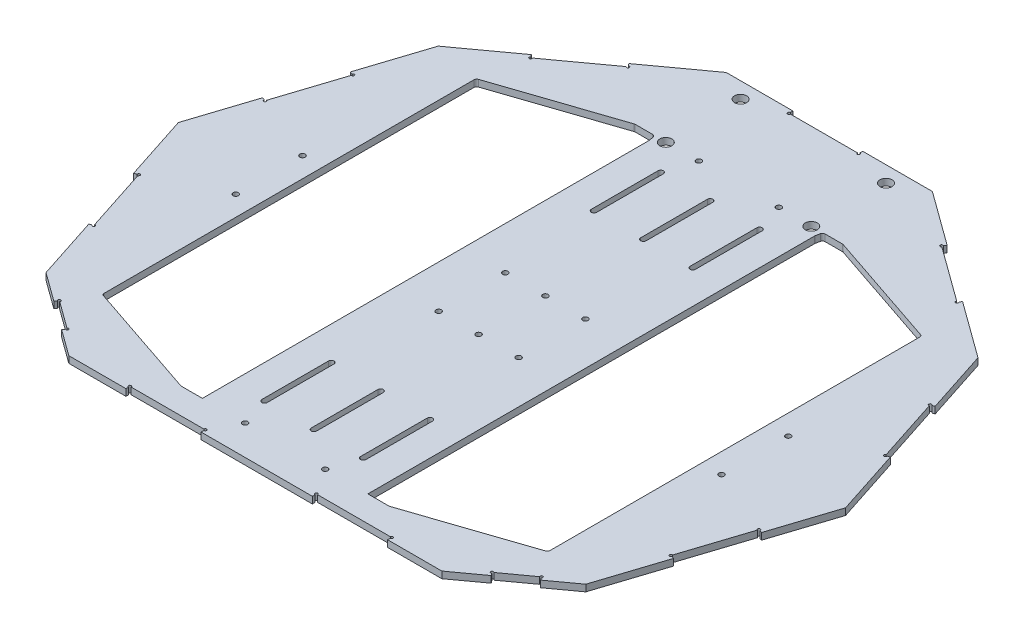
from build123d import *

# Parameters (mm, degrees)
SKETCH1_R           = 250
BOSS_EXTRUDE1_DEPTH = 5
SKETCH2_W           = 94
SKETCH2_H           = 280
CUT_EXTRUDE1_DEPTH  = 354.588744165
SKETCH3_R           = 2
CUT_EXTRUDE2_DEPTH  = 354.588744165
SKETCH4_W           = 10
SKETCH4_H           = 135
SKETCH4_H_2         = 40
SKETCH4_H_3         = 32.5
SKETCH4_H_4         = 72.5
CUT_EXTRUDE3_DEPTH  = 354.588744165
SKETCH5_OUTSIDE_W   = 643.424
SKETCH5_OUTSIDE_H   = 643.424
CUT_EXTRUDE4_DEPTH  = 6
CUT_EXTRUDE5_DEPTH  = 346.046056454
SKETCH7_W           = 52.3
SKETCH7_H           = 3
SKETCH7_W_2         = 56.4
CUT_EXTRUDE6_DEPTH  = 346.046056454
SKETCH8_R           = 1
CUT_EXTRUDE7_DEPTH  = 346.046056454
SKETCH9_W           = 15
SKETCH9_H           = 30
CUT_EXTRUDE8_DEPTH  = 346.046056454
SKETCH12_W          = 10
SKETCH12_H          = 20
CUT_EXTRUDE9_DEPTH  = 346.046056454
SKETCH14_R          = 2
CUT_EXTRUDE11_DEPTH = 346.046056454
CUT_EXTRUDE13_DEPTH = 346.046056454
FILLET1_R           = 2
SKETCH17_R          = 4.5
CUT_EXTRUDE14_DEPTH = 346.046056454
CUT_EXTRUDE15_DEPTH = 346.046056454
FILLET2_R           = 2


with BuildPart() as part:
    # Sketch1 → Boss-Extrude1 (new body)
    with BuildSketch(Plane(origin=(0, 0, 0), x_dir=(1, 0, 0), z_dir=(0, 1, 0))):
        with Locations(Location((0, 0, 0), (0, 0, 270))):
            Circle(SKETCH1_R)
    extrude(amount=BOSS_EXTRUDE1_DEPTH)

    # Sketch2 → Cut-Extrude1 (cut, through all)
    with BuildSketch(Plane(origin=(0, 5, 0), x_dir=(1, 0, 0), z_dir=(0, 1, 0))):
        with Locations((120, 0)):
            Rectangle(SKETCH2_W, SKETCH2_H)
        with Locations((-120, 0)):
            Rectangle(SKETCH2_W, SKETCH2_H)
    extrude(amount=-CUT_EXTRUDE1_DEPTH, mode=Mode.SUBTRACT)

    # Sketch3 → Cut-Extrude2 (cut, through all)
    with BuildSketch(Plane(origin=(0, 5, 0), x_dir=(1, 0, 0), z_dir=(0, 1, 0))):
        with Locations(Location((0, 25, 0), (0, 0, 270))):
            Circle(SKETCH3_R)
        with Locations(Location((0, -25, 0), (0, 0, 270))):
            Circle(SKETCH3_R)
        with Locations(Location((-182, -25, 0), (0, 0, 270))):
            Circle(SKETCH3_R)
        with Locations(Location((-182, 25, 0), (0, 0, 270))):
            Circle(SKETCH3_R)
        with Locations(Location((182, -25, 0), (0, 0, 270))):
            Circle(SKETCH3_R)
        with Locations(Location((182, 25, 0), (0, 0, 270))):
            Circle(SKETCH3_R)
    extrude(amount=-CUT_EXTRUDE2_DEPTH, mode=Mode.SUBTRACT)

    # Sketch4 → Cut-Extrude3 (cut, through all)
    with BuildSketch(Plane(origin=(0, 5, 0), x_dir=(1, 0, 0), z_dir=(0, 1, 0))):
        with Locations((68, 0)):
            Rectangle(SKETCH4_W, SKETCH4_H)
        with Locations((-68, 0)):
            Rectangle(SKETCH4_W, SKETCH4_H)
        with Locations((-68, 87.5)):
            Rectangle(SKETCH4_W, SKETCH4_H_2)
        with Locations((68, -87.5)):
            Rectangle(SKETCH4_W, SKETCH4_H_2)
        with Locations((-68, 123.75)):
            Rectangle(SKETCH4_W, SKETCH4_H_3)
        with Locations((68, -123.75)):
            Rectangle(SKETCH4_W, SKETCH4_H_3)
        with Locations((-68, -103.75)):
            Rectangle(SKETCH4_W, SKETCH4_H_4)
        with Locations((68, 103.75)):
            Rectangle(SKETCH4_W, SKETCH4_H_4)
    extrude(amount=-CUT_EXTRUDE3_DEPTH, mode=Mode.SUBTRACT)

    # Sketch5 outside → Cut-Extrude4 (cut)
    with BuildSketch(Plane(origin=(0, 5, 0), x_dir=(1, 0, 0), z_dir=(0, 1, 0))):
        Rectangle(SKETCH5_OUTSIDE_W, SKETCH5_OUTSIDE_H)
        Polygon((-139.754248594, -192.355221073), (139.754248594, -192.355221073), (202.254248594, -146.946313073), (250, 0), (202.254248594, 146.946313073), (77.254248594, 237.764129074), (-77.254248594, 237.764129074), (-202.254248594, 146.946313073), (-250, 0), (-202.254248594, -146.946313073), align=None, mode=Mode.SUBTRACT)
    extrude(amount=-CUT_EXTRUDE4_DEPTH, mode=Mode.SUBTRACT)

    # Sketch6 → Cut-Extrude5 (cut, through all)
    with BuildSketch(Plane(origin=(0, 5, 0), x_dir=(1, 0, 0), z_dir=(0, 1, 0))):
        with BuildLine():
            Line((35, -124.458041876), (35, -142.458041876))
            Line((35, -142.458041876), (35, -148.458041876))
            ThreePointArc((35, -148.458041876), (37, -150.458041876), (39, -148.458041876))
            Line((39, -148.458041876), (39, -142.458041876))
            Line((39, -142.458041876), (39, -124.458041876))
            Line((39, -124.458041876), (39, -98.458041876))
            ThreePointArc((39, -98.458041876), (37, -96.458041876), (35, -98.458041876))
            Line((35, -98.458041876), (35, -124.458041876))
        make_face()
        with BuildLine():
            Line((2, -124.458041876), (2, -142.458041876))
            Line((2, -142.458041876), (2, -148.458041876))
            ThreePointArc((2, -148.458041876), (0, -150.458041876), (-2, -148.458041876))
            Line((-2, -148.458041876), (-2, -142.458041876))
            Line((-2, -142.458041876), (-2, -104.458041876))
            Line((-2, -104.458041876), (-2, -98.458041876))
            ThreePointArc((-2, -98.458041876), (0, -96.458041876), (2, -98.458041876))
            Line((2, -98.458041876), (2, -124.458041876))
        make_face()
        with BuildLine():
            Line((-39, 148.458041876), (-39, 98.458041876))
            ThreePointArc((-39, 98.458041876), (-37, 96.458041876), (-35, 98.458041876))
            Line((-35, 98.458041876), (-35, 148.458041876))
            ThreePointArc((-35, 148.458041876), (-37, 150.458041876), (-39, 148.458041876))
        make_face()
        with BuildLine():
            Line((2, 122.458041876), (2, 104.458041876))
            Line((2, 104.458041876), (2, 98.458041876))
            ThreePointArc((2, 98.458041876), (0, 96.458041876), (-2, 98.458041876))
            Line((-2, 98.458041876), (-2, 104.458041876))
            Line((-2, 104.458041876), (-2, 122.458041876))
            Line((-2, 122.458041876), (-2, 148.458041876))
            ThreePointArc((-2, 148.458041876), (0, 150.458041876), (2, 148.458041876))
            Line((2, 148.458041876), (2, 122.458041876))
        make_face()
        with BuildLine():
            Line((35, 122.458041876), (35, 148.458041876))
            ThreePointArc((35, 148.458041876), (37, 150.458041876), (39, 148.458041876))
            Line((39, 148.458041876), (39, 122.458041876))
            Line((39, 122.458041876), (39, 104.458041876))
            Line((39, 104.458041876), (39, 98.458041876))
            ThreePointArc((39, 98.458041876), (37, 96.458041876), (35, 98.458041876))
            Line((35, 98.458041876), (35, 104.458041876))
            Line((35, 104.458041876), (35, 122.458041876))
        make_face()
        with BuildLine():
            Line((-35, -124.458041876), (-35, -98.458041876))
            ThreePointArc((-35, -98.458041876), (-37, -96.458041876), (-39, -98.458041876))
            Line((-39, -98.458041876), (-39, -104.458041876))
            Line((-39, -104.458041876), (-39, -142.458041876))
            Line((-39, -142.458041876), (-39, -148.458041876))
            ThreePointArc((-39, -148.458041876), (-37, -150.458041876), (-35, -148.458041876))
            Line((-35, -148.458041876), (-35, -142.458041876))
            Line((-35, -142.458041876), (-35, -124.458041876))
        make_face()
    extrude(amount=-CUT_EXTRUDE5_DEPTH, mode=Mode.SUBTRACT)

    # Sketch7 → Cut-Extrude6 (cut, through all)
    with BuildSketch(Plane(origin=(0, 5, 0), x_dir=(1, 0, 0), z_dir=(0, 1, 0))):
        Polygon((-233.869312894, -49.645150151), (-217.707724088, -99.385405953), (-214.854554539, -98.45835497), (-231.016143345, -48.718099167), align=None)
        Polygon((-218.3849357, 97.301162923), (-234.546524506, 47.56090712), (-231.693354957, 46.633856137), (-215.531766151, 96.374111939), align=None)
        Polygon((-119.4849357, 207.081738904), (-161.796524506, 176.340570209), (-160.033168749, 173.913519226), (-117.721579943, 204.654687921), align=None)
        with Locations((-1.095751406, 236.264129074)):
            Rectangle(SKETCH7_W, SKETCH7_H)
        Polygon((160.023561487, 177.628703243), (117.711972682, 208.369871938), (115.948616925, 205.942820955), (158.26020573, 175.20165226), align=None)
        Polygon((233.869312894, 49.645150151), (217.707724088, 99.385405953), (214.854554539, 98.45835497), (231.016143345, 48.718099167), align=None)
        Polygon((218.3849357, -97.301162923), (234.546524506, -47.56090712), (231.693354957, -46.633856137), (215.531766151, -96.374111939), align=None)
        Polygon((-180.831478583, -162.510866554), (-159.392528232, -178.08717574), (-157.629172475, -175.660124756), (-179.068122826, -160.083815571), align=None)
        Polygon((161.177018605, -176.790667593), (182.615968956, -161.214358407), (180.852613199, -158.787307424), (159.413662848, -174.36361661), align=None)
        with Locations((-68.774248594, -190.855221073)):
            Rectangle(SKETCH7_W_2, SKETCH7_H)
        with Locations((70.975751406, -190.855221073)):
            Rectangle(SKETCH7_W_2, SKETCH7_H)
    extrude(amount=-CUT_EXTRUDE6_DEPTH, mode=Mode.SUBTRACT)

    # Sketch8 → Cut-Extrude7 (cut, through all)
    with BuildSketch(Plane(origin=(0, 5, 0), x_dir=(1, 0, 0), z_dir=(0, 1, 0))):
        with Locations((-27.245751406, 234.764129074)):
            Circle(SKETCH8_R)
        with Locations((25.054248594, 234.764129074)):
            Circle(SKETCH8_R)
        with Locations((115.948616925, 205.942820955)):
            Circle(SKETCH8_R)
        with Locations((158.26020573, 175.20165226)):
            Circle(SKETCH8_R)
        with Locations((214.854554539, 98.45835497)):
            Circle(SKETCH8_R)
        with Locations((231.016143345, 48.718099168)):
            Circle(SKETCH8_R)
        with Locations((231.693354957, -46.633856137)):
            Circle(SKETCH8_R)
        with Locations((215.531766151, -96.374111939)):
            Circle(SKETCH8_R)
        with Locations((-179.068122826, -160.083815571)):
            Circle(SKETCH8_R)
        with Locations((-157.629172475, -175.660124756)):
            Circle(SKETCH8_R)
        with Locations((-96.974248594, -189.355221073)):
            Circle(SKETCH8_R)
        with Locations((-40.574248594, -189.355221073)):
            Circle(SKETCH8_R)
        with Locations((42.775751406, -189.355221073)):
            Circle(SKETCH8_R)
        with Locations((99.175751406, -189.355221073)):
            Circle(SKETCH8_R)
        with Locations((-214.854554539, -98.45835497)):
            Circle(SKETCH8_R)
        with Locations((-231.016143345, -48.718099168)):
            Circle(SKETCH8_R)
        with Locations((-231.693354957, 46.633856137)):
            Circle(SKETCH8_R)
        with Locations((-215.531766151, 96.374111939)):
            Circle(SKETCH8_R)
        with Locations((-160.033168749, 173.913519226)):
            Circle(SKETCH8_R)
        with Locations((-117.721579943, 204.654687921)):
            Circle(SKETCH8_R)
        with Locations((180.852613199, -158.787307424)):
            Circle(SKETCH8_R)
        with Locations((159.413662848, -174.36361661)):
            Circle(SKETCH8_R)
    extrude(amount=-CUT_EXTRUDE7_DEPTH, mode=Mode.SUBTRACT)

    # Sketch9 → Cut-Extrude8 (cut, through all)
    with BuildSketch(Plane(origin=(0, 5, 0), x_dir=(1, 0, 0), z_dir=(0, 1, 0))):
        with Locations((-70.5, 155)):
            Rectangle(SKETCH9_W, SKETCH9_H)
        with Locations((70.5, -155)):
            Rectangle(SKETCH9_W, SKETCH9_H)
    extrude(amount=-CUT_EXTRUDE8_DEPTH, mode=Mode.SUBTRACT)

    # Sketch12 → Cut-Extrude9 (cut, through all)
    with BuildSketch(Plane(origin=(0, 5, 0), x_dir=(1, 0, 0), z_dir=(0, 1, 0))):
        with Locations((-68, -150)):
            Rectangle(SKETCH12_W, SKETCH12_H)
        with Locations((68, 150)):
            Rectangle(SKETCH12_W, SKETCH12_H)
    extrude(amount=-CUT_EXTRUDE9_DEPTH, mode=Mode.SUBTRACT)

    # Sketch14 → Cut-Extrude11 (cut, through all)
    with BuildSketch(Plane(origin=(0, 5, 0), x_dir=(1, 0, 0), z_dir=(0, 1, 0))):
        with Locations(Location((-30, 170, 0), (0, 0, 270))):
            Circle(SKETCH14_R)
        with Locations(Location((30, 170, 0), (0, 0, 270))):
            Circle(SKETCH14_R)
        with Locations(Location((-30, -170, 0), (0, 0, 270))):
            Circle(SKETCH14_R)
        with Locations(Location((30, -170, 0), (0, 0, 270))):
            Circle(SKETCH14_R)
        with Locations(Location((-30, 25, 0), (0, 0, 270))):
            Circle(SKETCH14_R)
        with Locations(Location((30, 25, 0), (0, 0, 270))):
            Circle(SKETCH14_R)
        with Locations(Location((-30, -25, 0), (0, 0, 270))):
            Circle(SKETCH14_R)
        with Locations(Location((30, -25, 0), (0, 0, 270))):
            Circle(SKETCH14_R)
    extrude(amount=-CUT_EXTRUDE11_DEPTH, mode=Mode.SUBTRACT)

    # Sketch16 → Cut-Extrude13 (cut, through all)
    with BuildSketch(Plane(origin=(0, 5, 0), x_dir=(1, 0, 0), z_dir=(0, 1, 0))):
        Polygon((-73, -160), (-73, -140), (-167, -140), align=None)
        Polygon((167, -140), (78, -140), (78, -170), align=None)
        Polygon((73, 140), (73, 160), (167, 140), align=None)
        Polygon((-78, 140), (-167, 140), (-78, 170), align=None)
        Polygon((-78, -170), (-167, -140), (-73, -160), (-63, -160), (-63, -170), align=None)
        Polygon((73, 160), (63, 160), (63, 170), (78, 170), (167, 140), align=None)
    extrude(amount=-CUT_EXTRUDE13_DEPTH, mode=Mode.SUBTRACT)

    # Fillet1
    fillet1_edges = [part.edges().sort_by_distance(p)[0] for p in [
        (-167, 2.5, 140),
        (-167, 2.5, -140),
        (167, 2.5, -140),
        (167, 2.5, 140),
        (78, 2.5, 170),
        (-78, 2.5, -170),
        (-78, 2.5, 170),
        (78, 2.5, -170),
    ]]
    fillet(fillet1_edges, radius=FILLET1_R)

    # Sketch17 → Cut-Extrude14 (cut, through all)
    with BuildSketch(Plane.XZ):
        with Locations(Location((-54.499248594, -169.764129074, 0), (0, 0, 270))):
            Circle(SKETCH17_R)
        with Locations(Location((54.500751406, -225.764129074, 0), (0, 0, 270))):
            Circle(SKETCH17_R)
        with Locations(Location((-54.499248594, -225.764129074, 0), (0, 0, 270))):
            Circle(SKETCH17_R)
        with Locations(Location((54.500751406, -169.764129074, 0), (0, 0, 270))):
            Circle(SKETCH17_R)
    extrude(amount=-CUT_EXTRUDE14_DEPTH, mode=Mode.SUBTRACT)

    # Sketch18 → Cut-Extrude15 (cut, through all)
    with BuildSketch(Plane(origin=(0, 5, 0), x_dir=(1, 0, 0), z_dir=(0, 1, 0))):
        Polygon((-62, 165), (-62, -170), (-63, -170), (-63, 170), align=None)
        Polygon((63, 170), (62, 165), (62, -170), (63, -170), align=None)
    extrude(amount=-CUT_EXTRUDE15_DEPTH, mode=Mode.SUBTRACT)

    # Fillet2
    fillet2_edges = [part.edges().sort_by_distance(p)[0] for p in [
        (-63, 2.5, -170),
        (63, 2.5, -170),
        (-62, 2.5, -165),
        (62, 2.5, -165),
    ]]
    fillet(fillet2_edges, radius=FILLET2_R)


solid = part.part
